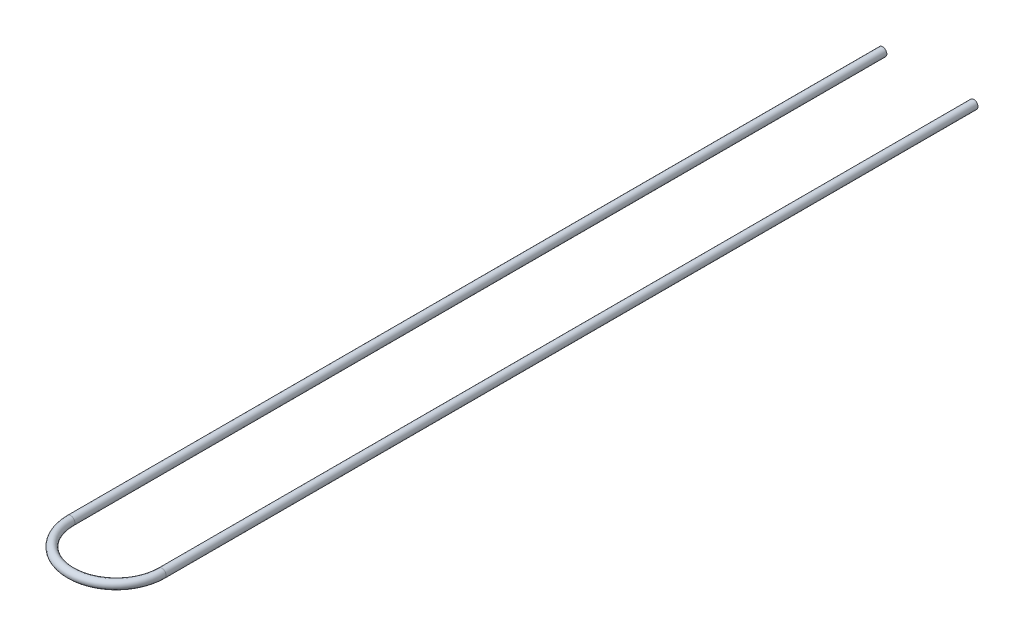
from build123d import *

# Parameters (mm, degrees)
SKETCH2_R   = 11.1
SKETCH2_R_2 = 9.95


with BuildPart() as part:
    # Sweep1: sweep along a path in Sketch1
    with BuildLine(Plane(origin=(0, 0, 0), x_dir=(1, 0, 0), z_dir=(0, 1, 0))) as sweep1_path:
        Line((200.31, -300), (200.31, -2440))
        ThreePointArc((200.31, -2440), (80.155, -2560.155), (-40, -2440))
        Line((-40, -2440), (-40, -300))
    # Sketch2 → Sweep1 (sweep)
    with BuildSketch(Plane(origin=(200.31, 0, 300), x_dir=(-1, 0, 0), z_dir=(0, 0, -1))):
        Circle(SKETCH2_R)
        Circle(SKETCH2_R_2, mode=Mode.SUBTRACT)
    sweep(path=sweep1_path.line)


solid = part.part
